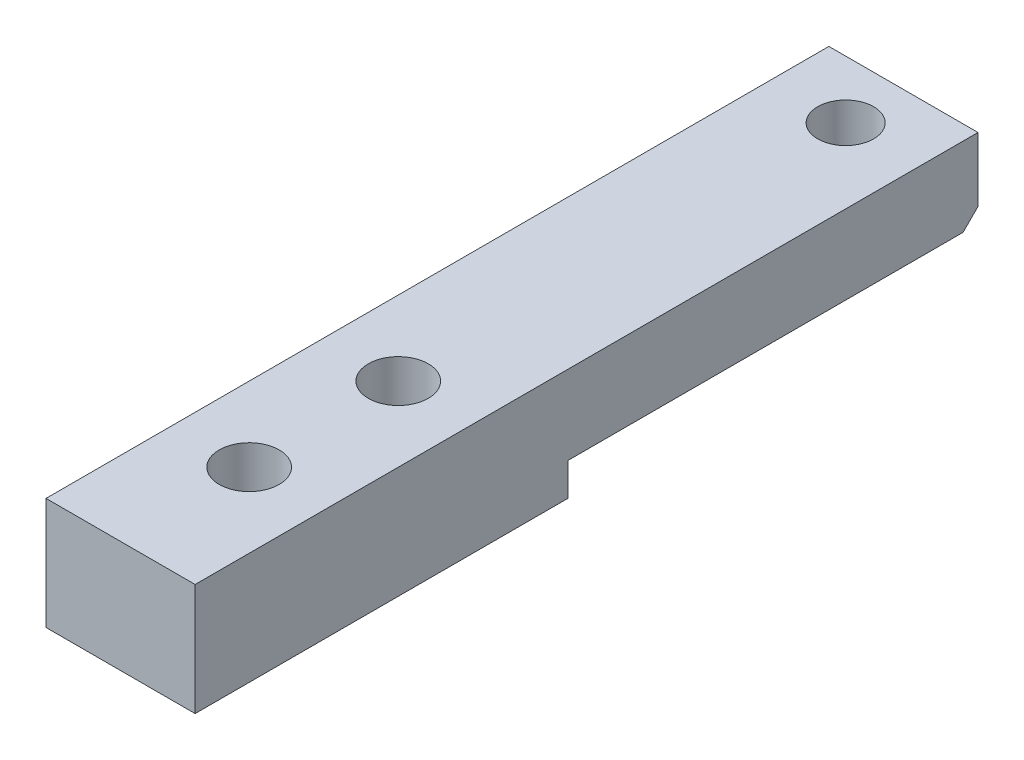
from build123d import *

# Parameters (mm, degrees)
BOSS_EXTRUDE1_DEPTH    = 6.35
F_10_CLEARANCE_HOLE1_D = 5.1054
CUT_EXTRUDE1_REACH     = 69.651
SKETCH4_R              = 2.38125
CHAMFER1_SIZE          = 1.27


with BuildPart() as part:
    # Sketch1 → Boss-Extrude1 (new, symmetric)
    with BuildSketch(Plane(origin=(0, 0, 0), x_dir=(0, 0, -1), z_dir=(1, 0, 0))):
        Polygon((0, 0), (31.75, 0), (31.75, 2.794), (66.675, 2.794), (66.675, 9.525), (0, 9.525), align=None)
    extrude(amount=BOSS_EXTRUDE1_DEPTH, both=True)

    # #10 Clearance Hole1 (through all)
    with Locations(Plane(origin=(0, 0, 0), x_dir=(-1, 0, 0), z_dir=(0, -1, 0))):
        with Locations((0, 23.65375), (0, 10.95375)):
            Hole(F_10_CLEARANCE_HOLE1_D / 2)

    # Sketch4 → Cut-Extrude1 (cut, up to next)
    with BuildSketch(Plane(origin=(0, 9.525, 0), x_dir=(1, 0, 0), z_dir=(0, 1, 0)), mode=Mode.PRIVATE) as cut_extrude1_sk1:
        with Locations(Location((0, 61.75375, 0), (0, 0, 270))):
            Circle(SKETCH4_R)
    cut_extrude1_tool1 = extrude(cut_extrude1_sk1.sketch, amount=-CUT_EXTRUDE1_REACH, mode=Mode.PRIVATE) & part.part
    add(cut_extrude1_tool1.solids().sort_by_distance((0, 9.525, -61.75375))[0], mode=Mode.SUBTRACT)

    # Chamfer1
    chamfer1_edges = [part.edges().sort_by_distance(p)[0] for p in [
        (0, 2.794, -66.675),
    ]]
    chamfer(chamfer1_edges, length=CHAMFER1_SIZE)


solid = part.part
